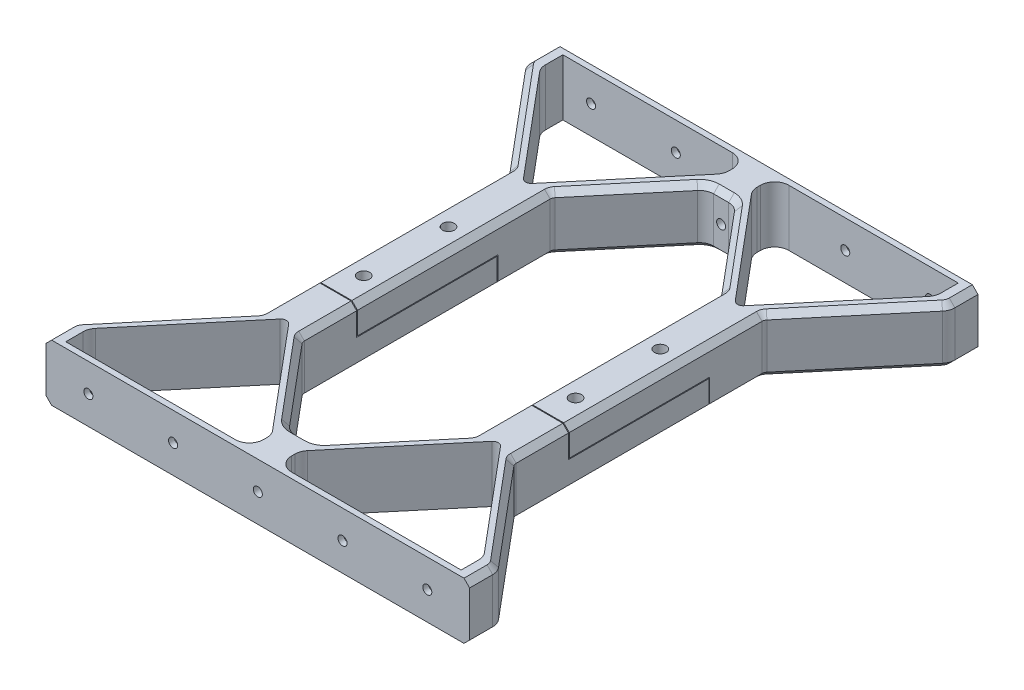
from build123d import *

# Parameters (mm, degrees)
SKETCH1_R               = 2.1
BOSS_EXTRUDE1_DEPTH     = 10
FILLET1_R               = 2
FILLET2_R               = 5
CUT_EXTRUDE1_REACH      = 209.58
CUT_EXTRUDE1_START      = 90
SKETCH3_R               = 1.6
CHAMFER1_SIZE           = 2
CUT_EXTRUDE2_DEPTH      = 118.579760163
CUT_EXTRUDE2_DEPTH_BACK = 118.579760163


with BuildPart() as part:
    # Sketch1 → Boss-Extrude1 (new, symmetric)
    with BuildSketch(Plane(origin=(0, 0, 0), x_dir=(1, 0, 0), z_dir=(0, 1, 0))):
        Polygon((0, -90), (75, -90), (75, -80), (45, -44.247392222), (45, 0), (30, 0), (30, -44.247392222), (5, -74.041232037), (0, -74.041232037), align=None)
        with Locations((37.5, -15)):
            Circle(SKETCH1_R, mode=Mode.SUBTRACT)
        Polygon((70, -80), (37.5, -41.268008241), (5, -80), (5, -88), (70, -88), align=None, mode=Mode.SUBTRACT)
    extrude(amount=BOSS_EXTRUDE1_DEPTH, both=True)

    # Fillet1
    fillet1_edges = [part.edges().sort_by_distance(p)[0] for p in [
        (30, 0, 44.247392222),
        (45, 0, 44.247392222),
        (37.5, 0, 41.268008241),
    ]]
    fillet(fillet1_edges, radius=FILLET1_R)

    # Fillet2
    fillet2_edges = [part.edges().sort_by_distance(p)[0] for p in [
        (5, 0, 88),
        (75, 0, 80),
        (70, 0, 80),
        (5, 0, 74.041232037),
        (5, 0, 80),
    ]]
    fillet(fillet2_edges, radius=FILLET2_R)

    # Mirror1: part across plane


with BuildPart() as part_1:
    add(part.part)
    add(part.part.mirror(Plane(origin=(0, 0, 0), x_dir=(0, 0, 1), z_dir=(1, 0, 0))))

    # Sketch3 → Cut-Extrude1 (cut, up to next)
    with BuildSketch(Plane.XY.offset(CUT_EXTRUDE1_START), mode=Mode.PRIVATE) as cut_extrude1_sk1:
        Circle(SKETCH3_R)
    cut_extrude1_tool1 = extrude(cut_extrude1_sk1.sketch, amount=-CUT_EXTRUDE1_REACH, mode=Mode.PRIVATE) & part_1.part
    # Sketch3 → Cut-Extrude1 (cut, up to next)
    with BuildSketch(Plane.XY.offset(CUT_EXTRUDE1_START), mode=Mode.PRIVATE) as cut_extrude1_sk2:
        with Locations((30, 0)):
            Circle(SKETCH3_R)
    cut_extrude1_tool2 = extrude(cut_extrude1_sk2.sketch, amount=-CUT_EXTRUDE1_REACH, mode=Mode.PRIVATE) & part_1.part
    # Sketch3 → Cut-Extrude1 (cut, up to next)
    with BuildSketch(Plane.XY.offset(CUT_EXTRUDE1_START), mode=Mode.PRIVATE) as cut_extrude1_sk3:
        with Locations((60, 0)):
            Circle(SKETCH3_R)
    cut_extrude1_tool3 = extrude(cut_extrude1_sk3.sketch, amount=-CUT_EXTRUDE1_REACH, mode=Mode.PRIVATE) & part_1.part
    # Sketch3 → Cut-Extrude1 (cut, up to next)
    with BuildSketch(Plane.XY.offset(CUT_EXTRUDE1_START), mode=Mode.PRIVATE) as cut_extrude1_sk4:
        with Locations((-30, 0)):
            Circle(SKETCH3_R)
    cut_extrude1_tool4 = extrude(cut_extrude1_sk4.sketch, amount=-CUT_EXTRUDE1_REACH, mode=Mode.PRIVATE) & part_1.part
    # Sketch3 → Cut-Extrude1 (cut, up to next)
    with BuildSketch(Plane.XY.offset(CUT_EXTRUDE1_START), mode=Mode.PRIVATE) as cut_extrude1_sk5:
        with Locations((-60, 0)):
            Circle(SKETCH3_R)
    cut_extrude1_tool5 = extrude(cut_extrude1_sk5.sketch, amount=-CUT_EXTRUDE1_REACH, mode=Mode.PRIVATE) & part_1.part
    add(cut_extrude1_tool1.solids().sort_by_distance((0, 0, 90))[0], mode=Mode.SUBTRACT)
    add(cut_extrude1_tool2.solids().sort_by_distance((30, 0, 90))[0], mode=Mode.SUBTRACT)
    add(cut_extrude1_tool3.solids().sort_by_distance((60, 0, 90))[0], mode=Mode.SUBTRACT)
    add(cut_extrude1_tool4.solids().sort_by_distance((-30, 0, 90))[0], mode=Mode.SUBTRACT)
    add(cut_extrude1_tool5.solids().sort_by_distance((-60, 0, 90))[0], mode=Mode.SUBTRACT)

    # Mirror2: part across plane


with BuildPart() as part_2:
    add(part_1.part)
    add(part_1.part.mirror(Plane.XY))

    # Chamfer1
    chamfer1_edges = [part_2.edges().sort_by_distance(p)[0] for p in [
        (30, 10, 0),
        (29.879385242, 10, -44.20349204),
        (29.879385242, 10, 44.20349204),
        (18.015386406, 10, -58.530098529),
        (18.015386406, 10, 58.530098529),
        (4.781553018, 10, -73.572770972),
        (4.781553018, 10, 73.572770972),
        (0, 10, -74.041232037),
        (0, 10, 74.041232037),
        (-4.781553018, 10, -73.572770972),
        (-4.781553018, 10, 73.572770972),
        (-18.015386406, 10, -58.530098529),
        (-18.015386406, 10, 58.530098529),
        (-29.879385242, 10, -44.20349204),
        (-29.879385242, 10, 44.20349204),
        (-30, 10, 0),
        (-75, -10, 85.909925586),
        (-75, -10, -85.909925586),
        (-74.698463104, -10, 80.109750455),
        (-74.698463104, -10, -80.109750455),
        (-59.649066665, -10, 61.705470048),
        (-59.649066665, -10, -61.705470048),
        (-45.120614758, -10, 44.20349204),
        (-45.120614758, -10, -44.20349204),
        (-45, -10, 0),
        (75, -10, 85.909925586),
        (75, -10, -85.909925586),
        (74.698463104, -10, 80.109750455),
        (74.698463104, -10, -80.109750455),
        (59.649066665, -10, 61.705470048),
        (59.649066665, -10, -61.705470048),
        (45.120614758, -10, 44.20349204),
        (45.120614758, -10, -44.20349204),
        (45, -10, 0),
        (-30, -10, 0),
        (-29.879385242, -10, -44.20349204),
        (-29.879385242, -10, 44.20349204),
        (-18.015386406, -10, -58.530098529),
        (-18.015386406, -10, 58.530098529),
        (-4.781553018, -10, -73.572770972),
        (-4.781553018, -10, 73.572770972),
        (0, -10, -74.041232037),
        (0, -10, 74.041232037),
        (4.781553018, -10, -73.572770972),
        (4.781553018, -10, 73.572770972),
        (18.015386406, -10, -58.530098529),
        (18.015386406, -10, 58.530098529),
        (29.879385242, -10, -44.20349204),
        (29.879385242, -10, 44.20349204),
        (30, -10, 0),
        (75, 10, 85.909925586),
        (75, 10, -85.909925586),
        (74.698463104, 10, 80.109750455),
        (74.698463104, 10, -80.109750455),
        (59.649066665, 10, 61.705470048),
        (59.649066665, 10, -61.705470048),
        (45.120614758, 10, 44.20349204),
        (45.120614758, 10, -44.20349204),
        (45, 10, 0),
        (-75, 10, 85.909925586),
        (-75, 10, -85.909925586),
        (-74.698463104, 10, 80.109750455),
        (-74.698463104, 10, -80.109750455),
        (-59.649066665, 10, 61.705470048),
        (-59.649066665, 10, -61.705470048),
        (-45.120614758, 10, 44.20349204),
        (-45.120614758, 10, -44.20349204),
        (-45, 10, 0),
    ]]
    chamfer(chamfer1_edges, length=CHAMFER1_SIZE)

    # Sketch4 → Cut-Extrude2 (cut, two sides: drawn at the far end of the back side and taken through both)
    with BuildSketch(Plane(origin=(0, 0, 0), x_dir=(0, 0, -1), z_dir=(1, 0, 0)).offset(-CUT_EXTRUDE2_DEPTH_BACK)):
        Polygon((25, -10), (25, 0.15), (-24.7, 0.15), (-24.7, 10), (-25, 10), (-25, -0.15), (24.7, -0.15), (24.7, -10), align=None)
    extrude(amount=CUT_EXTRUDE2_DEPTH + CUT_EXTRUDE2_DEPTH_BACK, mode=Mode.SUBTRACT)


with BuildPart() as cut_extrude2_piece_1:
    # of the separate pieces the step leaves, piece 1, a body of its own (cut_extrude2_pieces)
    add(part_2.part.solids().sort_by_distance((-73, 10, -90))[0])


with BuildPart() as cut_extrude2_piece_2:
    # of the separate pieces the step leaves, piece 2, a body of its own (cut_extrude2_pieces)
    add(part_2.part.solids().sort_by_distance((6.498683925, 8, 72.255170085))[0])


solid = Compound([cut_extrude2_piece_1.part, cut_extrude2_piece_2.part])
